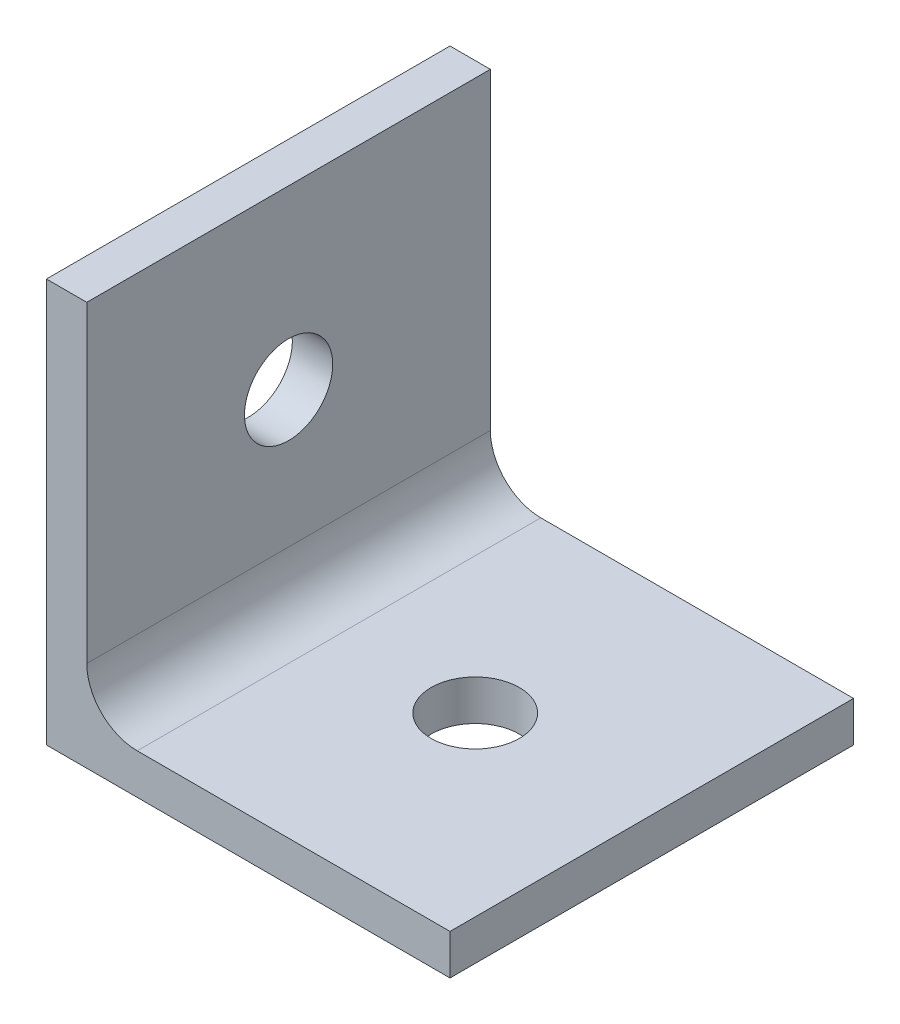
from build123d import *

# Parameters (mm, degrees)
AUFSATZ_AUFTRAGEN_MAIN_BODY_DEPTH = 40
SKIZZE3_R                         = 8.75
BOHRUNG_HORIZONTAL_DEPTH          = 115.821600755
SKIZZE4_R                         = 8.75
BOHRUNG_VERTIKAL_DEPTH            = 115.821600755


with BuildPart() as part:
    # Skizze1 → Aufsatz Auftragen Main Body (new, symmetric)
    with BuildSketch(Plane.XY):
        with BuildLine():
            Line((0, 0), (80, 0))
            Line((80, 0), (80, 8))
            Line((80, 8), (18, 8))
            ThreePointArc((18, 8), (10.928932188, 10.928932188), (8, 18))
            Line((8, 18), (8, 80))
            Line((8, 80), (0, 80))
            Line((0, 80), (0, 0))
        make_face()
    extrude(amount=AUFSATZ_AUFTRAGEN_MAIN_BODY_DEPTH, both=True)

    # Skizze3 → Bohrung Horizontal (cut, through all)
    with BuildSketch(Plane(origin=(0, 8, 0), x_dir=(1, 0, 0), z_dir=(0, 1, 0))):
        with Locations(Location((45, 0, 0), (0, 0, 180))):
            Circle(SKIZZE3_R)
    extrude(amount=-BOHRUNG_HORIZONTAL_DEPTH, mode=Mode.SUBTRACT)

    # Skizze4 → Bohrung Vertikal (cut, through all)
    with BuildSketch(Plane(origin=(8, 0, 0), x_dir=(0, 0, -1), z_dir=(1, 0, 0))):
        with Locations(Location((0, 45, 0), (0, 0, 90))):
            Circle(SKIZZE4_R)
    extrude(amount=-BOHRUNG_VERTIKAL_DEPTH, mode=Mode.SUBTRACT)


solid = part.part
